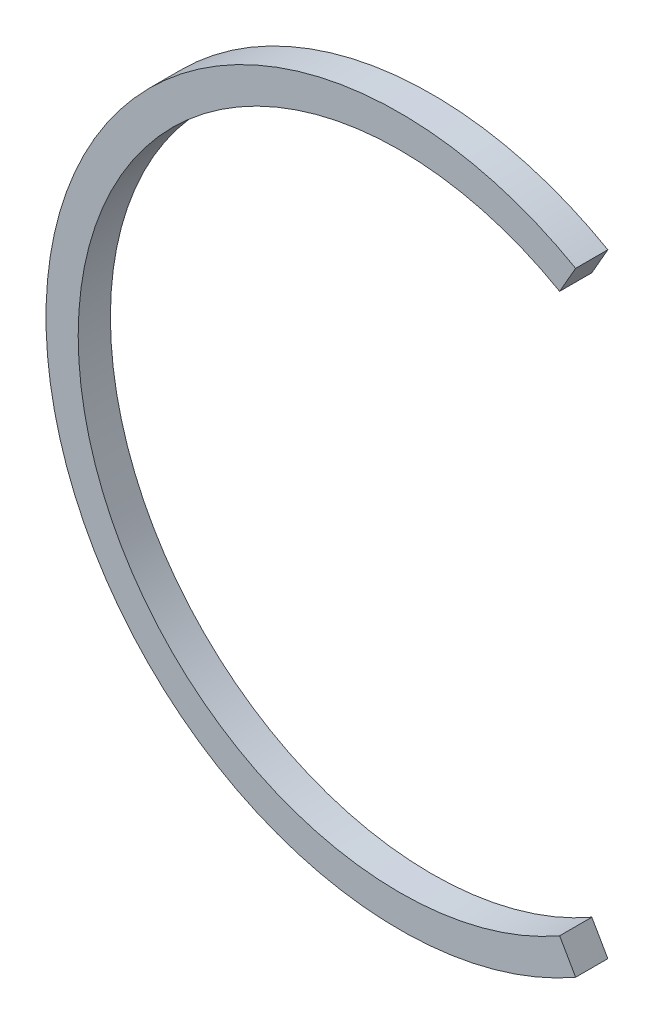
from build123d import *

# Parameters (mm, degrees)
BOSS_EXTRUDE1_DEPTH      = 0.5334
BOSS_EXTRUDE1_DEPTH_BACK = 0.5334


with BuildPart() as part:
    # Sketch2 → Boss-Extrude1 (new, two sides: drawn at the far end of the back side and taken through both)
    with BuildSketch(Plane.XY.offset(-BOSS_EXTRUDE1_DEPTH_BACK)):
        with BuildLine():
            Line((5.296630885, -9.2456), (5.826925276, -10.171261979))
            ThreePointArc((5.826925276, -10.171261979), (-11.7221, 0), (5.826925276, 10.171261979))
            Line((5.826925276, 10.171261979), (5.296630885, 9.2456))
            ThreePointArc((5.296630885, 9.2456), (-10.6553, 0), (5.296630885, -9.2456))
        make_face()
    extrude(amount=BOSS_EXTRUDE1_DEPTH + BOSS_EXTRUDE1_DEPTH_BACK)


solid = part.part
